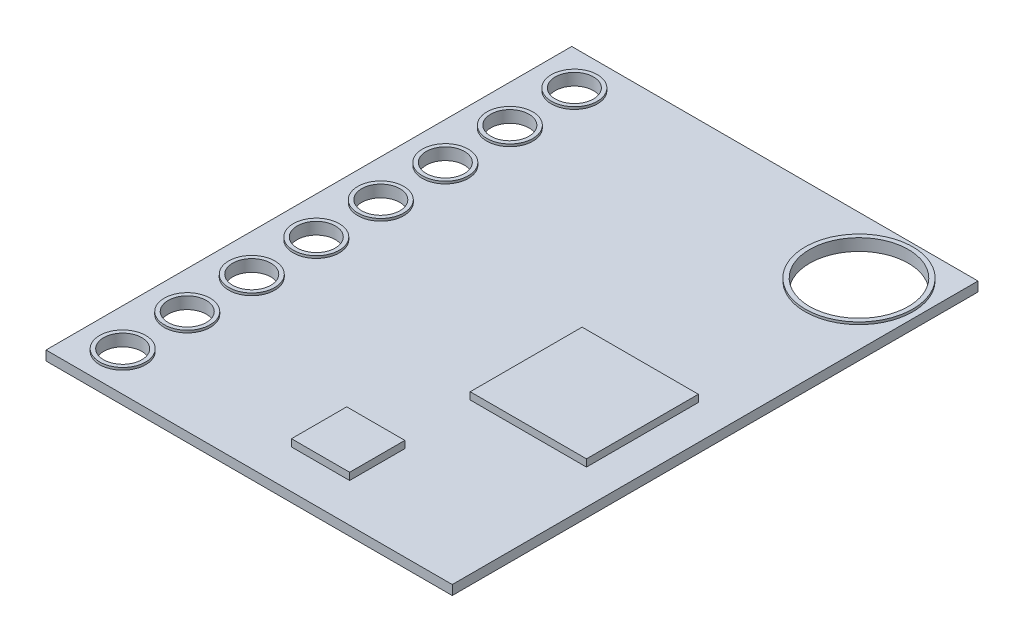
from build123d import *

# Parameters (mm, degrees)
SKETCH1_W           = 17
SKETCH1_H           = 22
SKETCH1_R           = 2.066566425
SKETCH1_R_2         = 0.8
BOSS_EXTRUDE2_DEPTH = 0.4
SKETCH3_R           = 2.253615782
SKETCH3_R_2         = 2.066566425
SKETCH3_R_3         = 0.962856641
SKETCH3_R_4         = 0.8
BOSS_EXTRUDE3_DEPTH = 0.1
SKETCH4_W           = 2.432070337
SKETCH4_H           = 2.310466819
SKETCH4_W_2         = 4.864140673
SKETCH4_H_2         = 4.681735398
BOSS_EXTRUDE4_DEPTH = 0.3


with BuildPart() as part:
    # Sketch1 → Boss-Extrude2 (new body)
    with BuildSketch(Plane(origin=(0, 0, 0), x_dir=(1, 0, 0), z_dir=(0, 1, 0))):
        with Locations((-2.156716418, -1.485074627)):
            Rectangle(SKETCH1_W, SKETCH1_H)
        with Locations(Location((3.843283582, 7.034200162, 0), (0, 0, 270))):
            Circle(SKETCH1_R, mode=Mode.SUBTRACT)
        with Locations(Location((-8.998366841, 7.966442948, 0), (0, 0, 270))):
            Circle(SKETCH1_R_2, mode=Mode.SUBTRACT)
        with Locations(Location((-8.998366841, 5.266442948, 0), (0, 0, 270))):
            Circle(SKETCH1_R_2, mode=Mode.SUBTRACT)
        with Locations(Location((-8.998366841, 2.566442948, 0), (0, 0, 270))):
            Circle(SKETCH1_R_2, mode=Mode.SUBTRACT)
        with Locations(Location((-8.998366841, -0.133557052, 0), (0, 0, 270))):
            Circle(SKETCH1_R_2, mode=Mode.SUBTRACT)
        with Locations(Location((-8.998366841, -2.833557052, 0), (0, 0, 270))):
            Circle(SKETCH1_R_2, mode=Mode.SUBTRACT)
        with Locations(Location((-8.998366841, -5.533557052, 0), (0, 0, 270))):
            Circle(SKETCH1_R_2, mode=Mode.SUBTRACT)
        with Locations(Location((-8.998366841, -8.233557052, 0), (0, 0, 270))):
            Circle(SKETCH1_R_2, mode=Mode.SUBTRACT)
        with Locations(Location((-8.998366841, -10.933557052, 0), (0, 0, 270))):
            Circle(SKETCH1_R_2, mode=Mode.SUBTRACT)
    extrude(amount=BOSS_EXTRUDE2_DEPTH)

    # Sketch3 → Boss-Extrude3 (add)
    # profile 1 of 9: a face of its own
    with BuildSketch(Plane(origin=(0, 0.4, 0), x_dir=(1, 0, 0), z_dir=(0, 1, 0))):
        with Locations(Location((3.843283582, 7.034200162, 0), (0, 0, 270))):
            Circle(SKETCH3_R)
        with Locations(Location((3.843283582, 7.034200162, 0), (0, 0, 270))):
            Circle(SKETCH3_R_2, mode=Mode.SUBTRACT)
    # profile 2 of 9: a face of its own
    with BuildSketch(Plane(origin=(0, 0.4, 0), x_dir=(1, 0, 0), z_dir=(0, 1, 0))):
        with Locations(Location((-8.998366841, 7.966442948, 0), (0, 0, 270))):
            Circle(SKETCH3_R_3)
        with Locations(Location((-8.998366841, 7.966442948, 0), (0, 0, 270))):
            Circle(SKETCH3_R_4, mode=Mode.SUBTRACT)
    # profile 3 of 9: a face of its own
    with BuildSketch(Plane(origin=(0, 0.4, 0), x_dir=(1, 0, 0), z_dir=(0, 1, 0))):
        with Locations(Location((-8.998366841, 5.266442948, 0), (0, 0, 270))):
            Circle(SKETCH3_R_3)
        with Locations(Location((-8.998366841, 5.266442948, 0), (0, 0, 270))):
            Circle(SKETCH3_R_4, mode=Mode.SUBTRACT)
    # profile 4 of 9: a face of its own
    with BuildSketch(Plane(origin=(0, 0.4, 0), x_dir=(1, 0, 0), z_dir=(0, 1, 0))):
        with Locations(Location((-8.998366841, 2.566442948, 0), (0, 0, 270))):
            Circle(SKETCH3_R_3)
        with Locations(Location((-8.998366841, 2.566442948, 0), (0, 0, 270))):
            Circle(SKETCH3_R_4, mode=Mode.SUBTRACT)
    # profile 5 of 9: a face of its own
    with BuildSketch(Plane(origin=(0, 0.4, 0), x_dir=(1, 0, 0), z_dir=(0, 1, 0))):
        with Locations(Location((-8.998366841, -0.133557052, 0), (0, 0, 270))):
            Circle(SKETCH3_R_3)
        with Locations(Location((-8.998366841, -0.133557052, 0), (0, 0, 270))):
            Circle(SKETCH3_R_4, mode=Mode.SUBTRACT)
    # profile 6 of 9: a face of its own
    with BuildSketch(Plane(origin=(0, 0.4, 0), x_dir=(1, 0, 0), z_dir=(0, 1, 0))):
        with Locations(Location((-8.998366841, -2.833557052, 0), (0, 0, 270))):
            Circle(SKETCH3_R_3)
        with Locations(Location((-8.998366841, -2.833557052, 0), (0, 0, 270))):
            Circle(SKETCH3_R_4, mode=Mode.SUBTRACT)
    # profile 7 of 9: a face of its own
    with BuildSketch(Plane(origin=(0, 0.4, 0), x_dir=(1, 0, 0), z_dir=(0, 1, 0))):
        with Locations(Location((-8.998366841, -5.533557052, 0), (0, 0, 270))):
            Circle(SKETCH3_R_3)
        with Locations(Location((-8.998366841, -5.533557052, 0), (0, 0, 270))):
            Circle(SKETCH3_R_4, mode=Mode.SUBTRACT)
    # profile 8 of 9: a face of its own
    with BuildSketch(Plane(origin=(0, 0.4, 0), x_dir=(1, 0, 0), z_dir=(0, 1, 0))):
        with Locations(Location((-8.998366841, -8.233557052, 0), (0, 0, 270))):
            Circle(SKETCH3_R_3)
        with Locations(Location((-8.998366841, -8.233557052, 0), (0, 0, 270))):
            Circle(SKETCH3_R_4, mode=Mode.SUBTRACT)
    # profile 9 of 9: a face of its own
    with BuildSketch(Plane(origin=(0, 0.4, 0), x_dir=(1, 0, 0), z_dir=(0, 1, 0))):
        with Locations(Location((-8.998366841, -10.933557052, 0), (0, 0, 270))):
            Circle(SKETCH3_R_3)
        with Locations(Location((-8.998366841, -10.933557052, 0), (0, 0, 270))):
            Circle(SKETCH3_R_4, mode=Mode.SUBTRACT)
    extrude(amount=BOSS_EXTRUDE3_DEPTH)

    # Sketch4 → Boss-Extrude4 (add)
    with BuildSketch(Plane(origin=(0, 0.4, 0), x_dir=(1, 0, 0), z_dir=(0, 1, 0))):
        with Locations((-0.788676854, -9.708512452)):
            Rectangle(SKETCH4_W, SKETCH4_H)
        with Locations((2.464217222, -3.081120785)):
            Rectangle(SKETCH4_W_2, SKETCH4_H_2)
    extrude(amount=BOSS_EXTRUDE4_DEPTH)


solid = part.part
